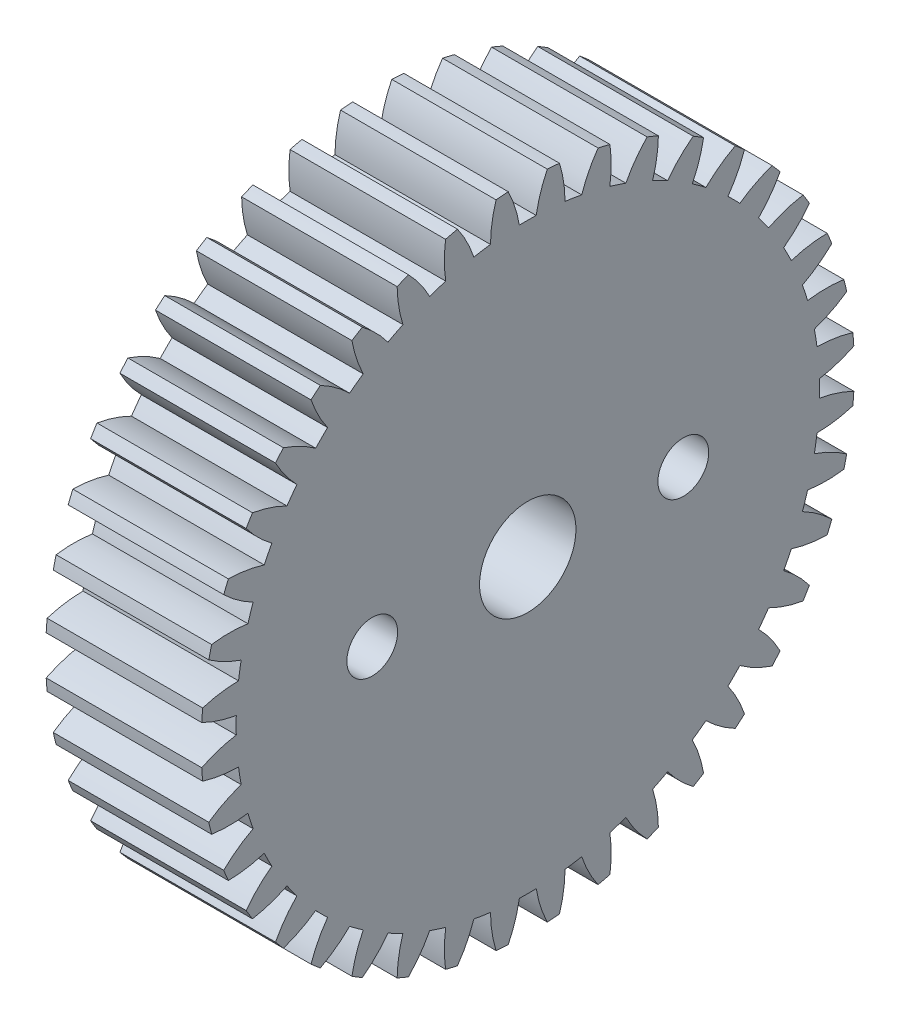
from build123d import *

# Parameters (mm, degrees)
BASPROSKE_W           = 10
BASPROSKE_H           = 21
TOOTHCUT_DEPTH        = 32.336879232
TEETHCUTS_COUNT       = 40
TEETHCUTS_ANGLE       = 351
BORSKE_R              = 3
BORE_DEPTH            = 50.0000508
F_4_CLEARANCE_HOLE1_D = 3.2639
SKETCH3_R             = 3.1
CUT_EXTRUDE1_DEPTH    = 32.286503812


with BuildPart() as part:
    # BasProSke → Base-Revolve (revolve)
    with BuildSketch(Plane(origin=(0, 0, 0), x_dir=(1, 0, 0), z_dir=(0, 1, 0)), mode=Mode.PRIVATE) as base_revolve_sk:
        with Locations((5, 10.5)):
            Rectangle(BASPROSKE_W, BASPROSKE_H)
    revolve(base_revolve_sk.sketch.rotate(Axis((-10, 0, 0), (1, 0, 0)), 180), axis=Axis((-10, 0, 0), (1, 0, 0)))

    # TooCutSke → ToothCut (cut, through all)
    with BuildSketch(Plane(origin=(0, 0, 0), x_dir=(0, 0, -1), z_dir=(1, 0, 0))):
        with BuildLine():
            ThreePointArc((0.541912224, 18.741166776), (0, 18.749), (-0.541912224, 18.741166776))
            ThreePointArc((-0.541912224, 18.741166776), (-0.82173342, 19.891076163), (-1.268136615, 20.987121639))
            ThreePointArc((-1.268136615, 20.987121639), (0, 21.0254), (1.268136615, 20.987121639))
            ThreePointArc((1.268136615, 20.987121639), (0.82173342, 19.891076163), (0.541912224, 18.741166776))
        make_face()
    toothcut = extrude(amount=TOOTHCUT_DEPTH, mode=Mode.SUBTRACT)

    # TeethCuts: ToothCut ×40 about axis
    teethcuts_axis = Axis((-10, 0, 0), (1, 0, 0))
    for i in range(1, TEETHCUTS_COUNT):
        add(toothcut.rotate(teethcuts_axis, i * TEETHCUTS_ANGLE / (TEETHCUTS_COUNT - 1)), mode=Mode.SUBTRACT)

    # BorSke → Bore (cut, symmetric)
    with BuildSketch(Plane(origin=(0, 0, 0), x_dir=(0, 0, -1), z_dir=(1, 0, 0))):
        with Locations(Location((0, 0, 0), (0, 0, 180))):
            Circle(BORSKE_R)
    extrude(amount=BORE_DEPTH, both=True, mode=Mode.SUBTRACT)

    # #4 Clearance Hole1 (through all)
    with Locations(Plane(origin=(10, 0, 0), x_dir=(0, 0, -1), z_dir=(1, 0, 0))):
        with Locations((-10, 0), (10, 0)):
            Hole(F_4_CLEARANCE_HOLE1_D / 2)

    # Sketch3 → Cut-Extrude1 (cut, through all)
    with BuildSketch(Plane(origin=(10, 0, 0), x_dir=(0, 0, -1), z_dir=(1, 0, 0))):
        Circle(SKETCH3_R)
    extrude(amount=-CUT_EXTRUDE1_DEPTH, mode=Mode.SUBTRACT)


solid = part.part
